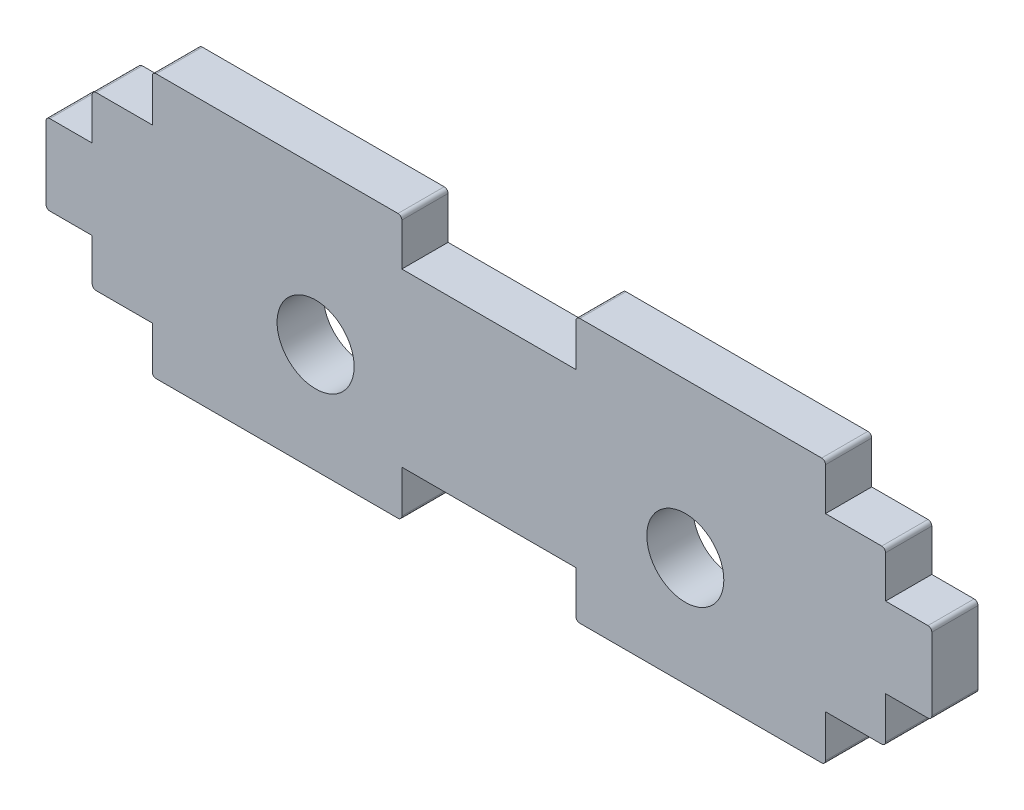
from build123d import *

# Parameters (mm, degrees)
SKETCH2_R           = 2.5
BOSS_EXTRUDE1_DEPTH = 3


with BuildPart() as part:
    # Sketch2 → Boss-Extrude1 (new body)
    with BuildSketch(Plane.XY):
        with BuildLine():
            Line((34.25, 2.05625), (49.95, 2.05625))
            ThreePointArc((49.95, 2.05625), (50.126776695, 2.129473305), (50.2, 2.30625))
            Line((50.2, 2.30625), (50.2, 5.05625))
            Line((50.2, 5.05625), (53.85, 5.05625))
            ThreePointArc((53.85, 5.05625), (54.026776695, 5.129473305), (54.1, 5.30625))
            Line((54.1, 5.30625), (54.1, 8.025))
            Line((54.1, 8.025), (56.85, 8.025))
            ThreePointArc((56.85, 8.025), (57.026776695, 8.098223305), (57.1, 8.275))
            Line((57.1, 8.275), (57.1, 12.975))
            ThreePointArc((57.1, 12.975), (57.026776695, 13.151776695), (56.85, 13.225))
            Line((56.85, 13.225), (54.1, 13.225))
            Line((54.1, 13.225), (54.1, 15.94375))
            ThreePointArc((54.1, 15.94375), (54.026776695, 16.120526695), (53.85, 16.19375))
            Line((53.85, 16.19375), (50.2, 16.19375))
            Line((50.2, 16.19375), (50.2, 18.94375))
            ThreePointArc((50.2, 18.94375), (50.126776695, 19.120526695), (49.95, 19.19375))
            Line((49.95, 19.19375), (34.25, 19.19375))
            ThreePointArc((34.25, 19.19375), (34.073223305, 19.120526695), (34, 18.94375))
            Line((34, 18.94375), (34, 16.19375))
            Line((34, 16.19375), (22.7, 16.19375))
            Line((22.7, 16.19375), (22.7, 18.94375))
            ThreePointArc((22.7, 18.94375), (22.626776695, 19.120526695), (22.45, 19.19375))
            Line((22.45, 19.19375), (6.75, 19.19375))
            ThreePointArc((6.75, 19.19375), (6.573223305, 19.120526695), (6.5, 18.94375))
            Line((6.5, 18.94375), (6.5, 16.19375))
            Line((6.5, 16.19375), (2.85, 16.19375))
            ThreePointArc((2.85, 16.19375), (2.673223305, 16.120526695), (2.6, 15.94375))
            Line((2.6, 15.94375), (2.6, 13.225))
            Line((2.6, 13.225), (-0.15, 13.225))
            ThreePointArc((-0.15, 13.225), (-0.326776695, 13.151776695), (-0.4, 12.975))
            Line((-0.4, 12.975), (-0.4, 8.275))
            ThreePointArc((-0.4, 8.275), (-0.326776695, 8.098223305), (-0.15, 8.025))
            Line((-0.15, 8.025), (2.6, 8.025))
            Line((2.6, 8.025), (2.6, 5.30625))
            ThreePointArc((2.6, 5.30625), (2.673223305, 5.129473305), (2.85, 5.05625))
            Line((2.85, 5.05625), (6.5, 5.05625))
            Line((6.5, 5.05625), (6.5, 2.30625))
            ThreePointArc((6.5, 2.30625), (6.573223305, 2.129473305), (6.75, 2.05625))
            Line((6.75, 2.05625), (22.45, 2.05625))
            ThreePointArc((22.45, 2.05625), (22.626776695, 2.129473305), (22.7, 2.30625))
            Line((22.7, 2.30625), (22.7, 5.05625))
            Line((22.7, 5.05625), (34, 5.05625))
            Line((34, 5.05625), (34, 2.30625))
            ThreePointArc((34, 2.30625), (34.073223305, 2.129473305), (34.25, 2.05625))
        make_face()
        with Locations((17.1, 9.15625)):
            Circle(SKETCH2_R, mode=Mode.SUBTRACT)
        with Locations((41.1, 9.15625)):
            Circle(SKETCH2_R, mode=Mode.SUBTRACT)
    extrude(amount=BOSS_EXTRUDE1_DEPTH)


solid = part.part
